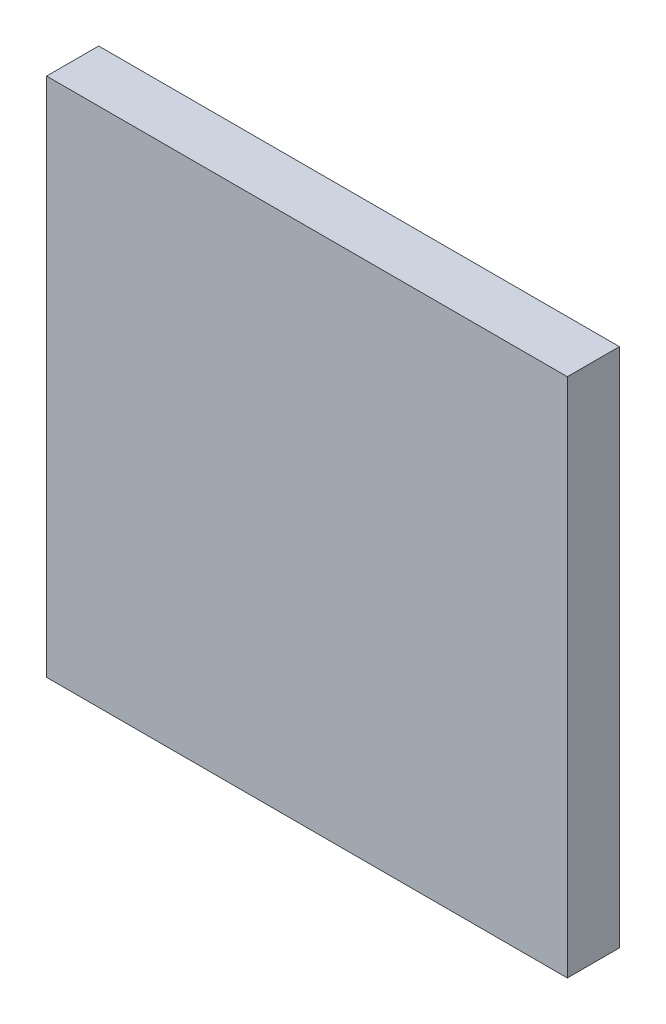
from build123d import *

# Parameters (mm, degrees)
SKETCH_1_W      = 20
SKETCH_1_H      = 20
EXTRUDE_1_DEPTH = 2


with BuildPart() as part:
    # Эскиз1 → Бобышка-Вытянуть1 (new body)
    with BuildSketch(Plane.XY):
        with Locations((10, 10)):
            Rectangle(SKETCH_1_W, SKETCH_1_H)
    extrude(amount=EXTRUDE_1_DEPTH)


solid = part.part
